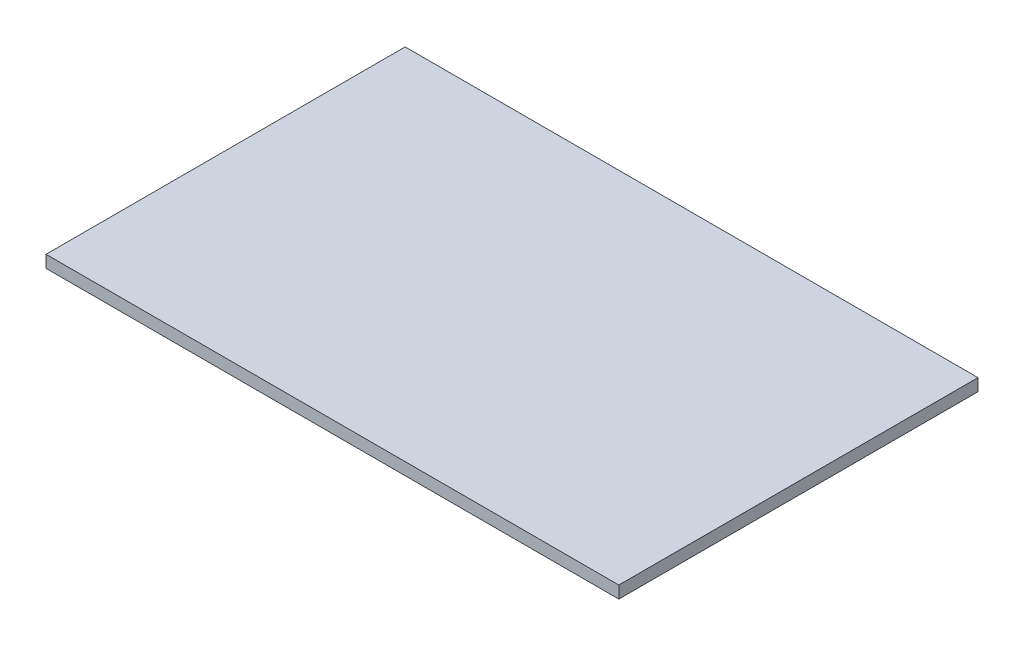
from build123d import *

# Parameters (mm, degrees)
SKETCH_1_W      = 56.3
SKETCH_1_H      = 35.3
EXTRUDE_1_DEPTH = 1.2


with BuildPart() as part:
    # 草图1 → 凸台-拉伸1 (new body)
    with BuildSketch(Plane(origin=(0, 0, 0), x_dir=(1, 0, 0), z_dir=(0, 1, 0))):
        with Locations((-28.15, 17.65)):
            Rectangle(SKETCH_1_W, SKETCH_1_H)
    extrude(amount=EXTRUDE_1_DEPTH)


solid = part.part
